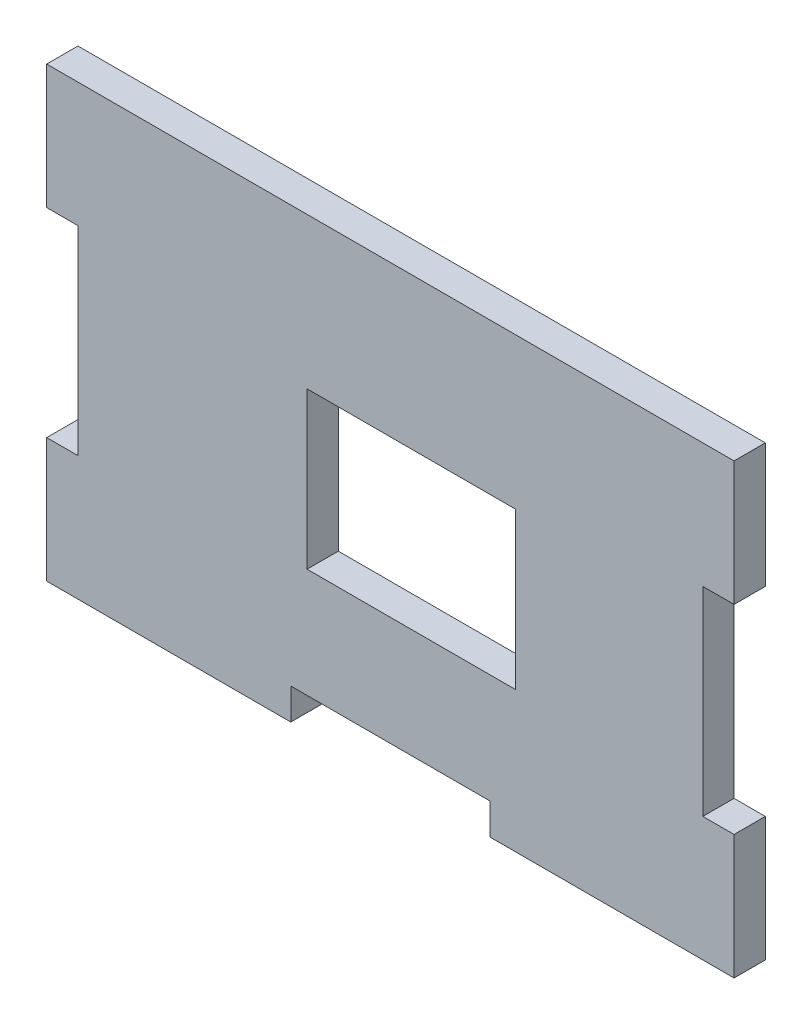
from build123d import *

# Parameters (mm, degrees)
BOSS_EXTRUDE1_DEPTH = 3
SKETCH2_W           = 20
SKETCH2_H           = 15
CUT_EXTRUDE2_DEPTH  = 10


with BuildPart() as part:
    # Sketch1 → Boss-Extrude1 (new body)
    with BuildSketch(Plane.XY):
        Polygon((41.712301942, -43.626199709), (41.712301942, -55.563699709), (44.712301942, -55.563699709), (44.712301942, -74.688699709), (41.712301942, -74.688699709), (41.712301942, -86.626199709), (65.149801942, -86.626199709), (65.149801942, -83.626199709), (84.274801942, -83.626199709), (84.274801942, -86.626199709), (103.399801942, -86.626199709), (107.712301942, -86.626199709), (107.712301942, -74.688699709), (104.712301942, -74.688699709), (104.712301942, -55.563699709), (107.712301942, -55.563699709), (107.712301942, -43.626199709), align=None)
    extrude(amount=BOSS_EXTRUDE1_DEPTH)

    # Sketch2 → Cut-Extrude2 (cut)
    with BuildSketch(Plane.XY.offset(3)):
        with Locations((76.712301942, -65.632728749)):
            Rectangle(SKETCH2_W, SKETCH2_H)
    extrude(amount=-CUT_EXTRUDE2_DEPTH, mode=Mode.SUBTRACT)


solid = part.part
